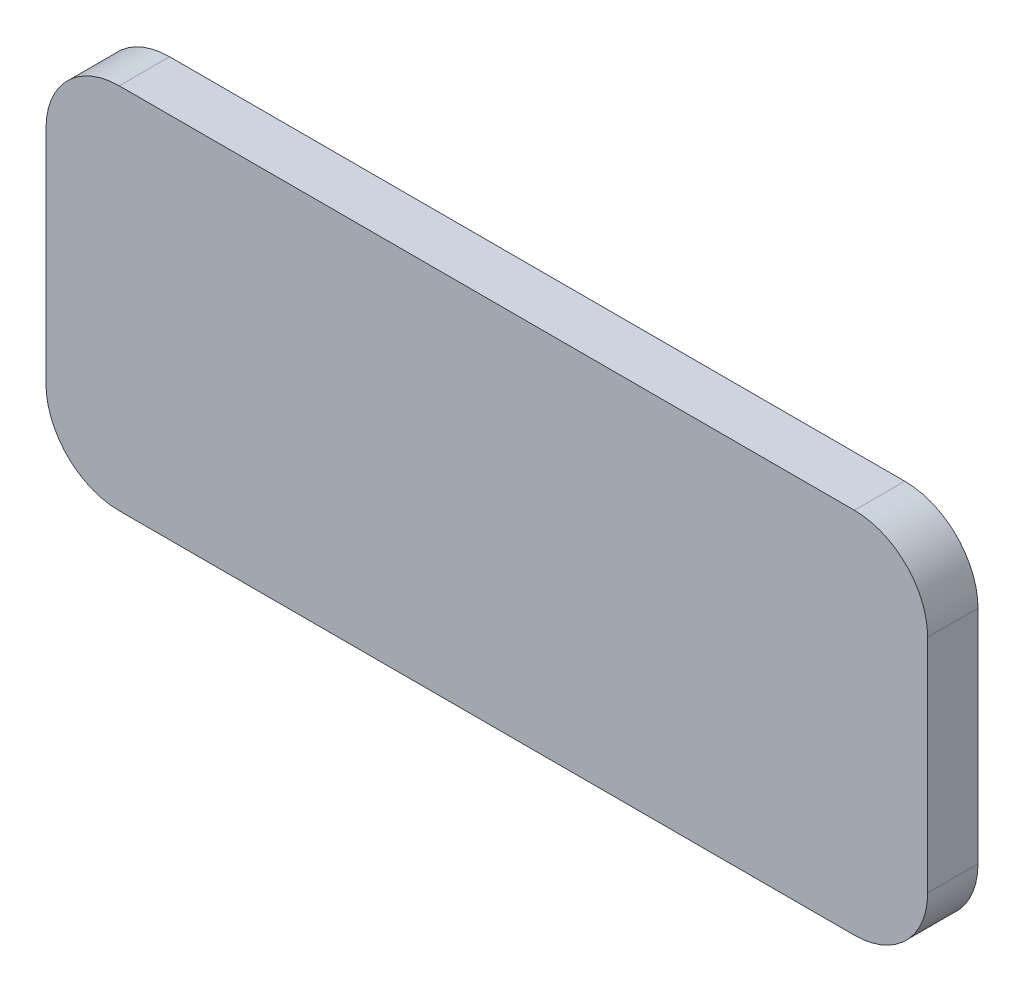
from build123d import *

# Parameters (mm, degrees)
SKETCH1_W           = 172.974
SKETCH1_H           = 102.108
BOSS_EXTRUDE1_DEPTH = 13.97
SKETCH2_R           = 7.4676
SKETCH2_R_2         = 3.014975044
SKETCH2_W           = 7.81218406
SKETCH2_H           = 2.407827673
BOSS_EXTRUDE3_DEPTH = 3.048
SKETCH3_R           = 7.4676
SKETCH3_R_2         = 3.014975044
BOSS_EXTRUDE5_DEPTH = 3.048


with BuildPart() as part:
    # Sketch1 → Boss-Extrude1 (new body)
    with BuildSketch(Plane.XY):
        with Locations((58.9637029, 33.169946412)):
            Rectangle(SKETCH1_W, SKETCH1_H)
        with BuildLine():
            Line((-27.5232971, 84.223946412), (-43.0172971, 84.223946412))
            ThreePointArc((-43.0172971, 84.223946412), (-57.385706894, 78.272356205), (-63.3372971, 63.903946412))
            Line((-63.3372971, 63.903946412), (-63.3372971, 2.435946412))
            ThreePointArc((-63.3372971, 2.435946412), (-57.385706894, -11.932463382), (-43.0172971, -17.884053588))
            Line((-43.0172971, -17.884053588), (-27.5232971, -17.884053588))
            Line((-27.5232971, -17.884053588), (-27.5232971, 84.223946412))
        make_face()
        with BuildLine():
            Line((160.9447029, 84.223946412), (145.4507029, 84.223946412))
            Line((145.4507029, 84.223946412), (145.4507029, -17.884053588))
            Line((145.4507029, -17.884053588), (160.9447029, -17.884053588))
            ThreePointArc((160.9447029, -17.884053588), (175.313112694, -11.932463382), (181.2647029, 2.435946412))
            Line((181.2647029, 2.435946412), (181.2647029, 63.903946412))
            ThreePointArc((181.2647029, 63.903946412), (175.313112694, 78.272356205), (160.9447029, 84.223946412))
        make_face()
    extrude(amount=BOSS_EXTRUDE1_DEPTH)

    # Sketch2 → Boss-Extrude3 (add)
    with BuildSketch(Plane(origin=(0, 0, 0), x_dir=(-1, 0, 0), z_dir=(0, 0, -1))):
        with Locations(Location((-163.4847029, 58.823946412, 0), (0, 0, 180))):
            Circle(SKETCH2_R)
        with Locations(Location((-170.337090886, 26.676001086, 0), (0, 0, 180))):
            Circle(SKETCH2_R_2)
        with Locations(Location((-163.221177768, 32.823656386, 0), (0, 0, 180))):
            Circle(SKETCH2_R_2)
        with Locations(Location((-156.732358191, 26.205188985, 0), (0, 0, 180))):
            Circle(SKETCH2_R_2)
        with Locations(Location((-163.721455714, 19.973644896, 0), (0, 0, 180))):
            Circle(SKETCH2_R_2)
        with Locations((-152.730393721, 74.856056835)):
            Rectangle(SKETCH2_W, SKETCH2_H)
    extrude(amount=BOSS_EXTRUDE3_DEPTH)

    # Sketch3 → Boss-Extrude5 (add)
    with BuildSketch(Plane(origin=(0, 0, 0), x_dir=(-1, 0, 0), z_dir=(0, 0, -1))):
        with Locations(Location((45.487523866, 28.516423037, 0), (0, 0, 180))):
            Circle(SKETCH3_R)
        with Locations(Location((44.957454366, 53.116068624, 0), (0, 0, 180))):
            Circle(SKETCH3_R_2)
        with Locations(Location((38.341819194, 59.818424813, 0), (0, 0, 180))):
            Circle(SKETCH3_R_2)
        with Locations(Location((45.457732312, 65.966080113, 0), (0, 0, 180))):
            Circle(SKETCH3_R_2)
        with Locations(Location((51.94655189, 59.347612713, 0), (0, 0, 180))):
            Circle(SKETCH3_R_2)
        Polygon((38.47340824, 76.391412748), (41.190295926, 76.391412748), (41.190295926, 73.983585075), (38.47340824, 73.983585075), (38.47340824, 71.443585075), (35.93340824, 71.443585075), (35.93340824, 73.983585075), (33.570295926, 73.983585075), (33.570295926, 76.391412748), (35.93340824, 76.391412748), (35.93340824, 78.931412748), (38.47340824, 78.931412748), align=None)
    extrude(amount=BOSS_EXTRUDE5_DEPTH)


solid = part.part
